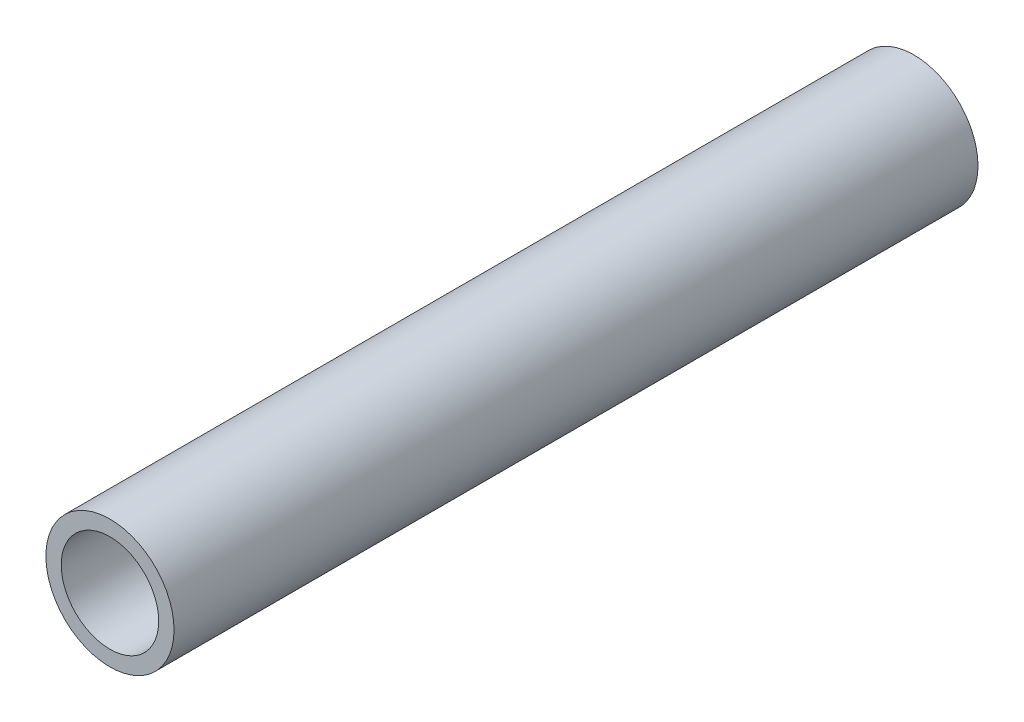
from build123d import *

# Parameters (mm, degrees)
SKETCH1_R           = 16.7005
SKETCH1_R_2         = 12.7
BOSS_EXTRUDE1_DEPTH = 209.55


with BuildPart() as part:
    # Sketch1 → Boss-Extrude1 (new body)
    with BuildSketch(Plane.XY):
        Circle(SKETCH1_R)
        Circle(SKETCH1_R_2, mode=Mode.SUBTRACT)
    extrude(amount=BOSS_EXTRUDE1_DEPTH)


solid = part.part
